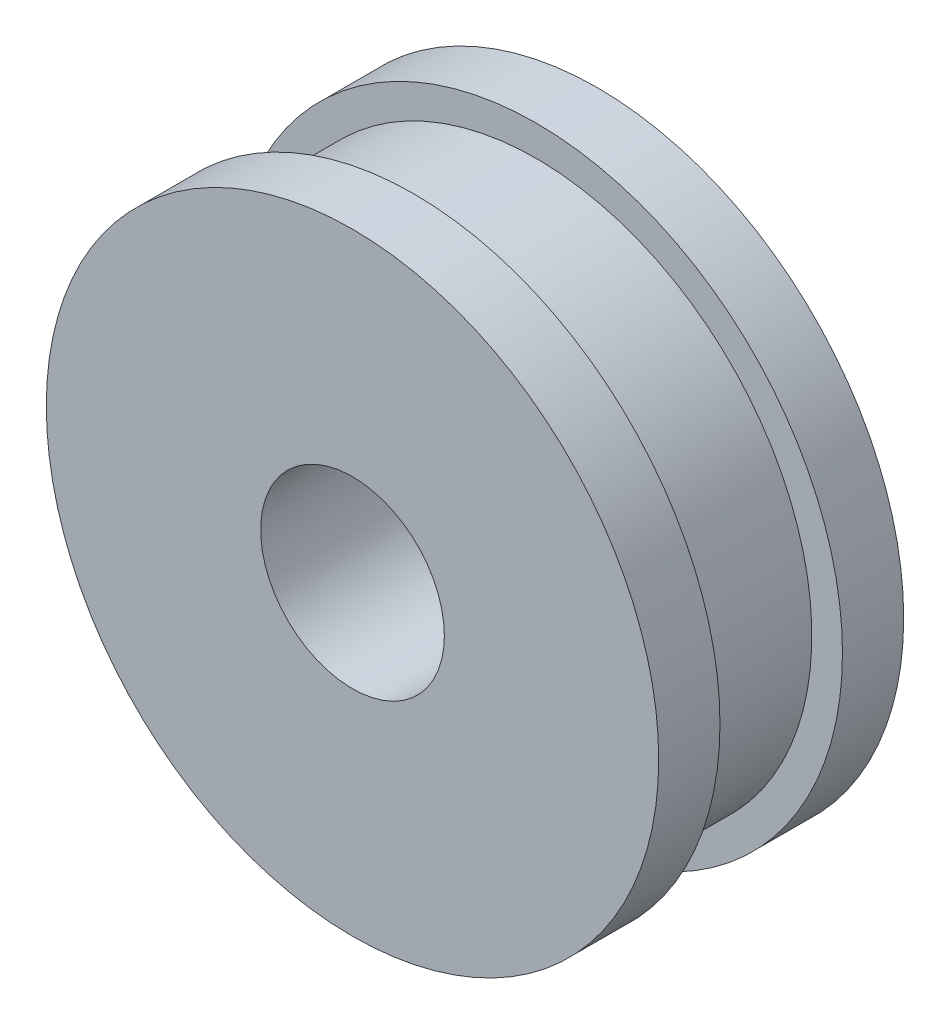
from build123d import *

# Parameters (mm, degrees)
SKETCH1_R           = 50
SKETCH1_R_2         = 15
BOSS_EXTRUDE1_DEPTH = 40
SKETCH2_W           = 20
SKETCH2_H           = 5


with BuildPart() as part:
    # Sketch1 → Boss-Extrude1 (new body)
    with BuildSketch(Plane.XY):
        Circle(SKETCH1_R)
        Circle(SKETCH1_R_2, mode=Mode.SUBTRACT)
    extrude(amount=BOSS_EXTRUDE1_DEPTH)

    # Sketch2 → Cut-Revolve1 (revolve, cut)
    with BuildSketch(Plane(origin=(0, 0, 0), x_dir=(0, 0, -1), z_dir=(1, 0, 0)), mode=Mode.PRIVATE) as cut_revolve1_sk:
        with Locations((-20, 47.5)):
            Rectangle(SKETCH2_W, SKETCH2_H)
        with Locations((-20, -47.5)):
            Rectangle(SKETCH2_W, SKETCH2_H)
    revolve(cut_revolve1_sk.sketch.rotate(Axis((0, 0, -46.879295237), (0, 0, 1)), 90), axis=Axis((0, 0, -46.879295237), (0, 0, 1)), mode=Mode.SUBTRACT)


solid = part.part
